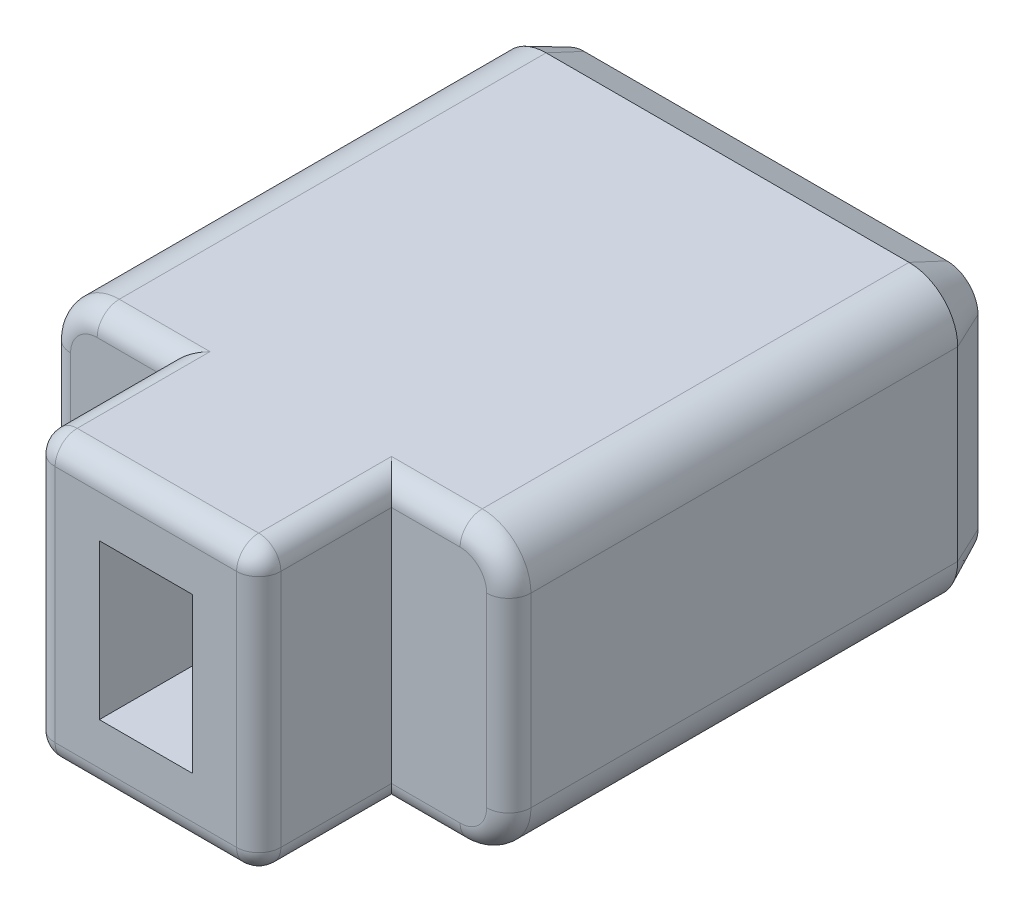
from build123d import *

# Parameters (mm, degrees)
BOSS_EXTRU_1_DEPTH      = 14
ESQUISSE3_W             = 2.1
ESQUISSE3_H             = 3.5
ENL_V_MAT_EXTRU_1_DEPTH = 3
ESQUISSE4_OUTSIDE_W     = 16.116
ESQUISSE4_OUTSIDE_H     = 12.116
ESQUISSE4_OUTSIDE_W_2   = 5.1
ESQUISSE4_OUTSIDE_H_2   = 6.4
ENL_V_MAT_EXTRU_2_DEPTH = 3
CONG_1_R                = 0.5
CHANFREIN1_SIZE         = 0.4
CHANFREIN1_SIZE2        = 0.857802768
ENL_V_MAT_EXTRU_3_DEPTH = 0.3
BOSS_EXTRU_2_DEPTH      = 0.3


with BuildPart() as part:
    # Esquisse2 → Boss.-Extru.1 (new body)
    with BuildSketch(Plane.XY):
        with BuildLine():
            Line((1.1, 0), (9.3, 0))
            ThreePointArc((9.3, 0), (10.077817459, 0.322182541), (10.4, 1.1))
            Line((10.4, 1.1), (10.4, 5.3))
            ThreePointArc((10.4, 5.3), (10.077817459, 6.077817459), (9.3, 6.4))
            Line((9.3, 6.4), (1.1, 6.4))
            ThreePointArc((1.1, 6.4), (0.322182541, 6.077817459), (0, 5.3))
            Line((0, 5.3), (0, 1.1))
            ThreePointArc((0, 1.1), (0.322182541, 0.322182541), (1.1, 0))
        make_face()
    extrude(amount=BOSS_EXTRU_1_DEPTH)

    # Esquisse3 → Enlèv. mat.-Extru.1 (cut)
    with BuildSketch(Plane.XY.offset(14)):
        with Locations((5.2, 3.2)):
            Rectangle(ESQUISSE3_W, ESQUISSE3_H)
    extrude(amount=-ENL_V_MAT_EXTRU_1_DEPTH, mode=Mode.SUBTRACT)

    # Esquisse4 outside → Enlèv. mat.-Extru.2 (cut)
    with BuildSketch(Plane.XY.offset(14)):
        with Locations((5.2, 3.2)):
            Rectangle(ESQUISSE4_OUTSIDE_W, ESQUISSE4_OUTSIDE_H)
        with Locations((5.2, 3.2)):
            Rectangle(ESQUISSE4_OUTSIDE_W_2, ESQUISSE4_OUTSIDE_H_2, mode=Mode.SUBTRACT)
    extrude(amount=-ENL_V_MAT_EXTRU_2_DEPTH, mode=Mode.SUBTRACT)

    # Congé1
    cong_1_edges = [part.edges().sort_by_distance(p)[0] for p in [
        (8.525, 0, 11),
        (10.077817459, 0.322182541, 11),
        (10.4, 3.2, 11),
        (10.077817459, 6.077817459, 11),
        (1.875, 6.4, 11),
        (0.322182541, 6.077817459, 11),
        (1.875, 0, 11),
        (0.322182541, 0.322182541, 11),
        (7.75, 6.4, 12.5),
        (2.65, 6.4, 12.5),
        (7.75, 0, 12.5),
        (2.65, 0, 12.5),
        (2.65, 3.2, 14),
        (5.2, 6.4, 14),
        (7.75, 3.2, 14),
        (5.2, 0, 14),
        (8.525, 6.4, 11),
        (0, 3.2, 11),
    ]]
    fillet(cong_1_edges, radius=CONG_1_R)

    # Chanfrein1
    chanfrein1_edges = [part.edges().sort_by_distance(p)[0] for p in [
        (5.2, 0, 0),
        (10.077817459, 0.322182541, 0),
        (0.322182541, 0.322182541, 0),
        (10.4, 3.2, 0),
        (0, 3.2, 0),
        (10.077817459, 6.077817459, 0),
        (0.322182541, 6.077817459, 0),
        (5.2, 6.4, 0),
    ]]
    chanfrein1_side = [part.faces().sort_by_distance(p)[0] for p in [
        (5.2, 3.2, 0),
    ]]
    chamfer(chanfrein1_edges, length=CHANFREIN1_SIZE, length2=CHANFREIN1_SIZE2, reference=chanfrein1_side[0])

    # Esquisse5 → Enlèv. mat.-Extru.3 (cut)
    with BuildSketch(Plane(origin=(0, 0, 0), x_dir=(-1, 0, 0), z_dir=(0, 0, -1))):
        Polygon((-4.748076923, 1.3), (-5.456410256, 1.3), (-5.456410256, 5.3), (-5.097435897, 5.3), (-5.097435897, 1.71025641), (-4.533333333, 1.71025641), align=None)
    extrude(amount=-ENL_V_MAT_EXTRU_3_DEPTH, mode=Mode.SUBTRACT)


with BuildPart() as body_2:
    # Esquisse5<2> → Boss.-Extru.2 (new body)
    with BuildSketch(Plane(origin=(0, 0, 0), x_dir=(-1, 0, 0), z_dir=(0, 0, -1))):
        Polygon((-4.748076923, 1.3), (-5.456410256, 1.3), (-5.456410256, 5.3), (-5.097435897, 5.3), (-5.097435897, 1.71025641), (-4.533333333, 1.71025641), align=None)
    extrude(amount=BOSS_EXTRU_2_DEPTH)


solid = Compound([part.part, body_2.part])
